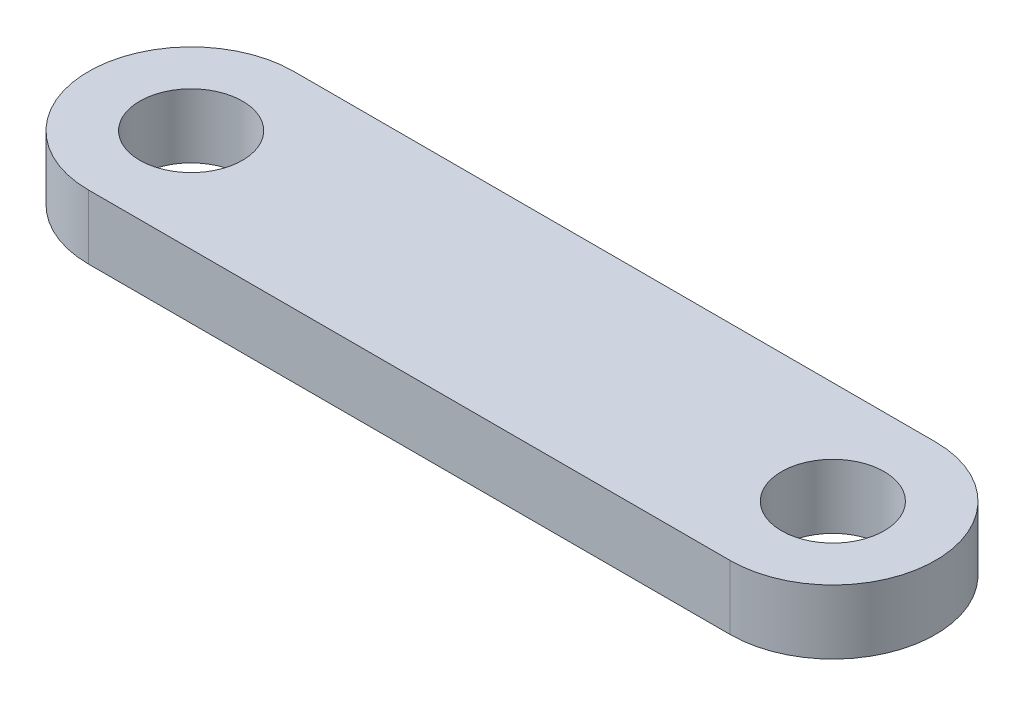
from build123d import *

# Parameters (mm, degrees)
SKETCH1_R           = 4
BOSS_EXTRUDE1_DEPTH = 5


with BuildPart() as part:
    # Sketch1 → Boss-Extrude1 (new body)
    with BuildSketch(Plane(origin=(0, 0, 0), x_dir=(1, 0, 0), z_dir=(0, 1, 0))):
        with BuildLine():
            Line((-25, -8), (25, -8))
            ThreePointArc((25, -8), (33, 0), (25, 8))
            Line((25, 8), (-25, 8))
            ThreePointArc((-25, 8), (-33, 0), (-25, -8))
        make_face()
        with Locations(Location((-25, 0, 0), (0, 0, 270))):
            Circle(SKETCH1_R, mode=Mode.SUBTRACT)
        with Locations(Location((25, 0, 0), (0, 0, 270))):
            Circle(SKETCH1_R, mode=Mode.SUBTRACT)
    extrude(amount=BOSS_EXTRUDE1_DEPTH)


solid = part.part
